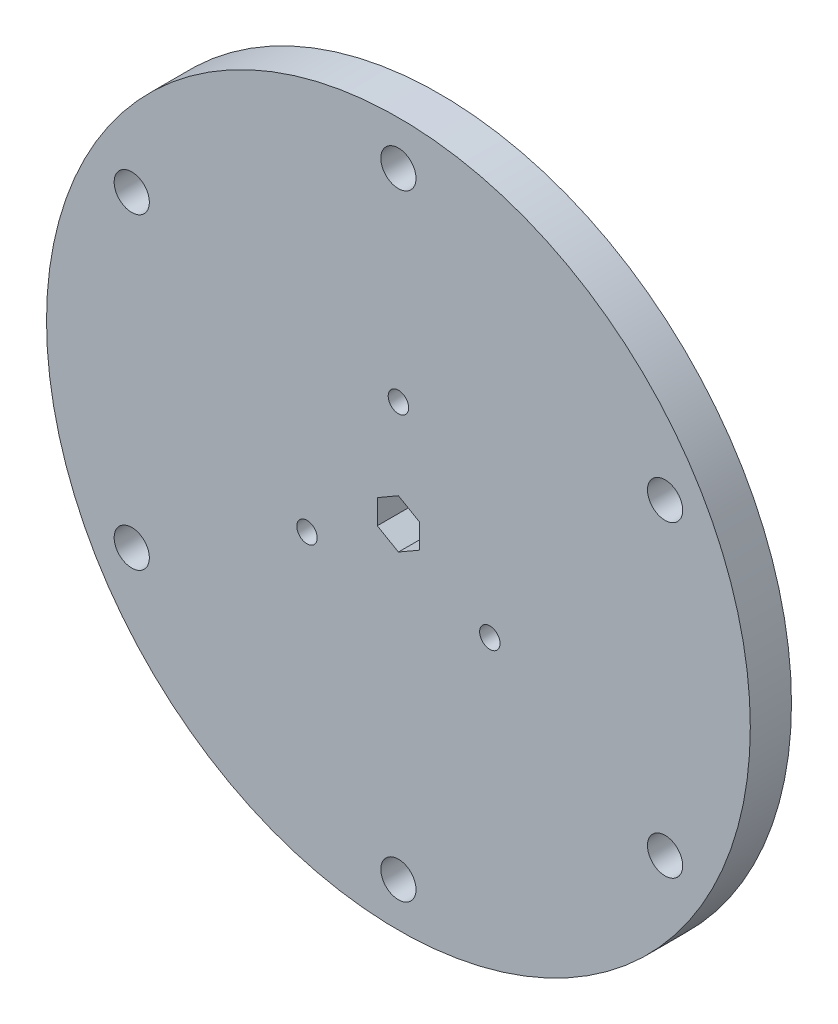
from build123d import *

# Parameters (mm, degrees)
SKETCH1_R                   = 50.8
BOSS_EXTRUDE1_DEPTH         = 2.9718
SKETCH2_R                   = 2.54
CUT_EXTRUDE1_DEPTH          = 73.087491155
CIRPATTERN1_COUNT           = 6
CUT_EXTRUDE2_DEPTH          = 73.087491155
F_32_0_116_DIAMETER_HOLE1_D = 2.9464
CIRPATTERN2_COUNT           = 3


with BuildPart() as part:
    # Sketch1 → Boss-Extrude1 (new, symmetric)
    with BuildSketch(Plane.XY):
        Circle(SKETCH1_R)
    extrude(amount=BOSS_EXTRUDE1_DEPTH, both=True)

    # Sketch2 → Cut-Extrude1 (cut, through all)
    with BuildSketch(Plane.XY.offset(2.9718)):
        with Locations((0, 44.45)):
            Circle(SKETCH2_R)
    cut_extrude1 = extrude(amount=-CUT_EXTRUDE1_DEPTH, mode=Mode.SUBTRACT)

    # CirPattern1: Cut-Extrude1 ×6 about axis
    cirpattern1_axis = Axis((0, 0, -3.4925), (0, 0, 1))
    for i in range(1, CIRPATTERN1_COUNT):
        add(cut_extrude1.rotate(cirpattern1_axis, i * 360 / CIRPATTERN1_COUNT), mode=Mode.SUBTRACT)

    # Sketch3 → Cut-Extrude2 (cut, through all)
    with BuildSketch(Plane.XY.offset(2.9718)):
        Polygon((0, 3.519527241), (3.048, 1.75976362), (3.048, -1.75976362), (0, -3.519527241), (-3.048, -1.75976362), (-3.048, 1.75976362), align=None)
    extrude(amount=-CUT_EXTRUDE2_DEPTH, mode=Mode.SUBTRACT)

    # #32 (0.116) Diameter Hole1 (through all)
    with Locations(Plane.XY.offset(2.9718)):
        with Locations((0, 15.24)):
            f_32_0_116_diameter_hole1 = Hole(F_32_0_116_DIAMETER_HOLE1_D / 2)

    # CirPattern2: #32 (0.116) Diameter Hole1 ×3 about axis
    cirpattern2_axis = Axis((0, 0, -3.4925), (0, 0, 1))
    for i in range(1, CIRPATTERN2_COUNT):
        add(f_32_0_116_diameter_hole1.rotate(cirpattern2_axis, i * 360 / CIRPATTERN2_COUNT), mode=Mode.SUBTRACT)


solid = part.part
